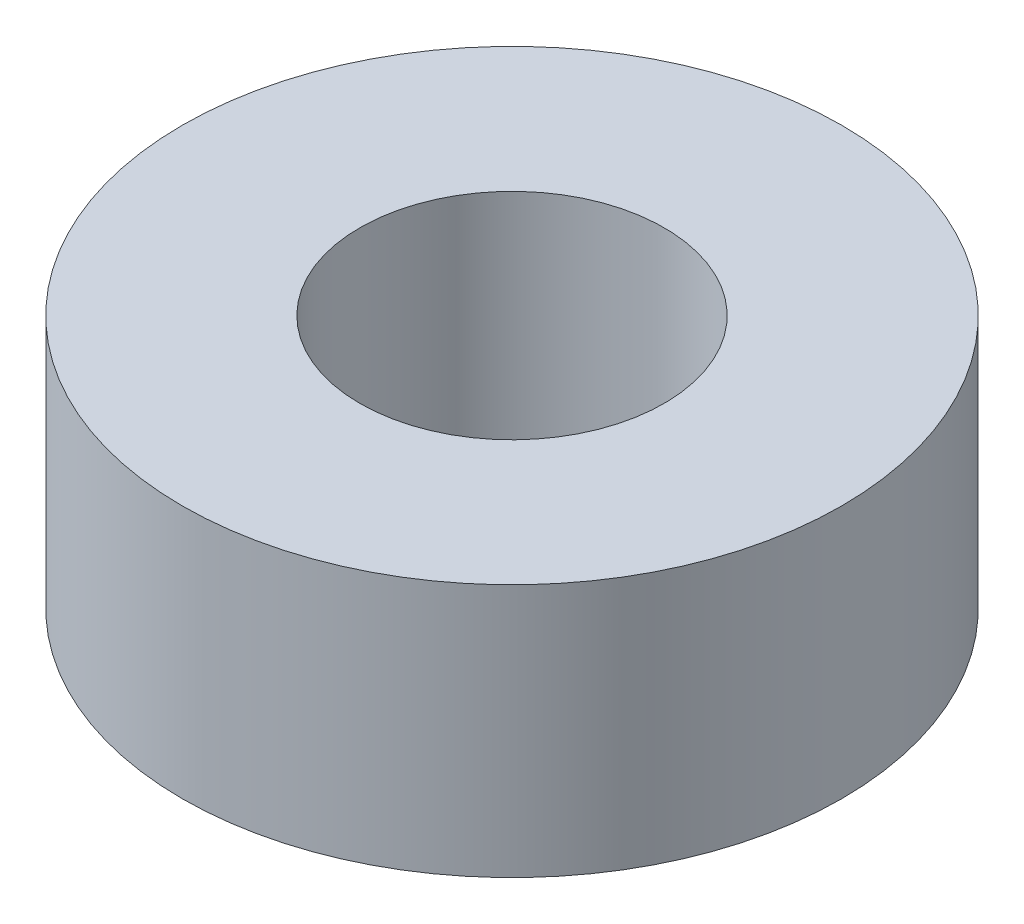
from build123d import *

# Parameters (mm, degrees)
ESQUISSE1_R        = 6.5
ESQUISSE1_R_2      = 3
BOSS_EXTRU_1_DEPTH = 5


with BuildPart() as part:
    # Esquisse1 → Boss.-Extru.1 (new body)
    with BuildSketch(Plane(origin=(0, 0, 0), x_dir=(1, 0, 0), z_dir=(0, 1, 0))):
        with Locations(Location((0, 0, 0), (0, 0, 270))):
            Circle(ESQUISSE1_R)
        with Locations(Location((0, 0, 0), (0, 0, 270))):
            Circle(ESQUISSE1_R_2, mode=Mode.SUBTRACT)
    extrude(amount=BOSS_EXTRU_1_DEPTH)


solid = part.part
